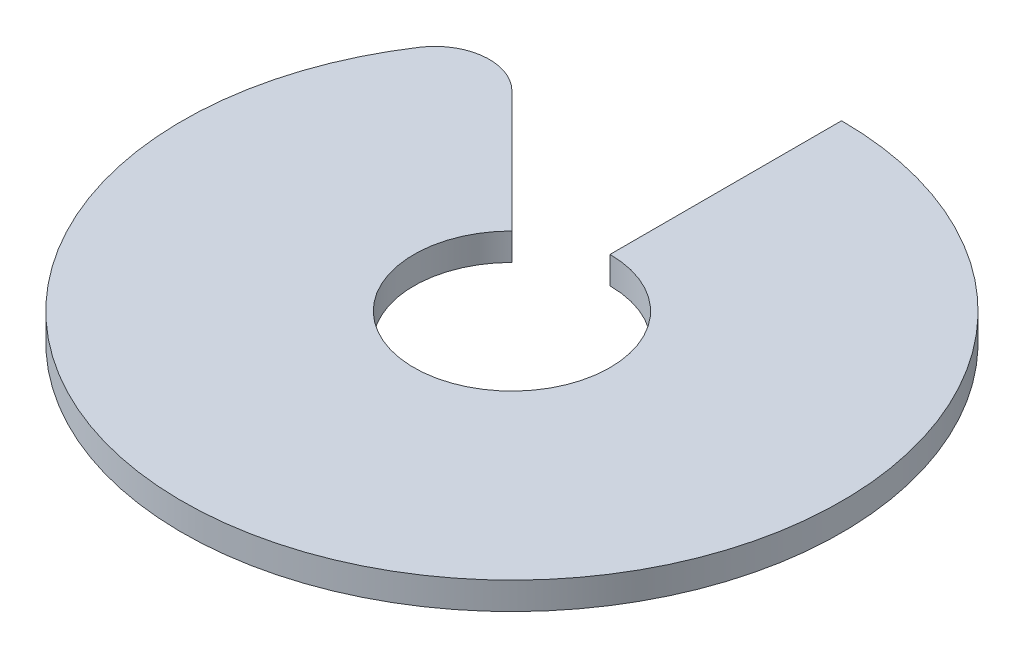
from build123d import *

# Parameters (mm, degrees)
EXTRUDE_1_DEPTH = 5
FILLET_1_R      = 10


with BuildPart() as part:
    # Эскиз1 → Бобышка-Вытянуть1 (new body)
    with BuildSketch(Plane(origin=(0, 0, 0), x_dir=(1, 0, 0), z_dir=(0, 1, 0))):
        with BuildLine():
            Line((-12.727922061, 12.727922061), (-42.779960262, 42.779960262))
            ThreePointArc((-42.779960262, 42.779960262), (23.152347658, -55.894711717), (0, 60.5))
            Line((0, 60.5), (0, 18))
            ThreePointArc((0, 18), (6.888301783, -16.629831585), (-12.727922061, 12.727922061))
        make_face()
    extrude(amount=EXTRUDE_1_DEPTH)

    # Скругление1
    fillet_1_edges = [part.edges().sort_by_distance(p)[0] for p in [
        (-42.779960262, 2.5, -42.779960262),
    ]]
    fillet(fillet_1_edges, radius=FILLET_1_R)


solid = part.part
